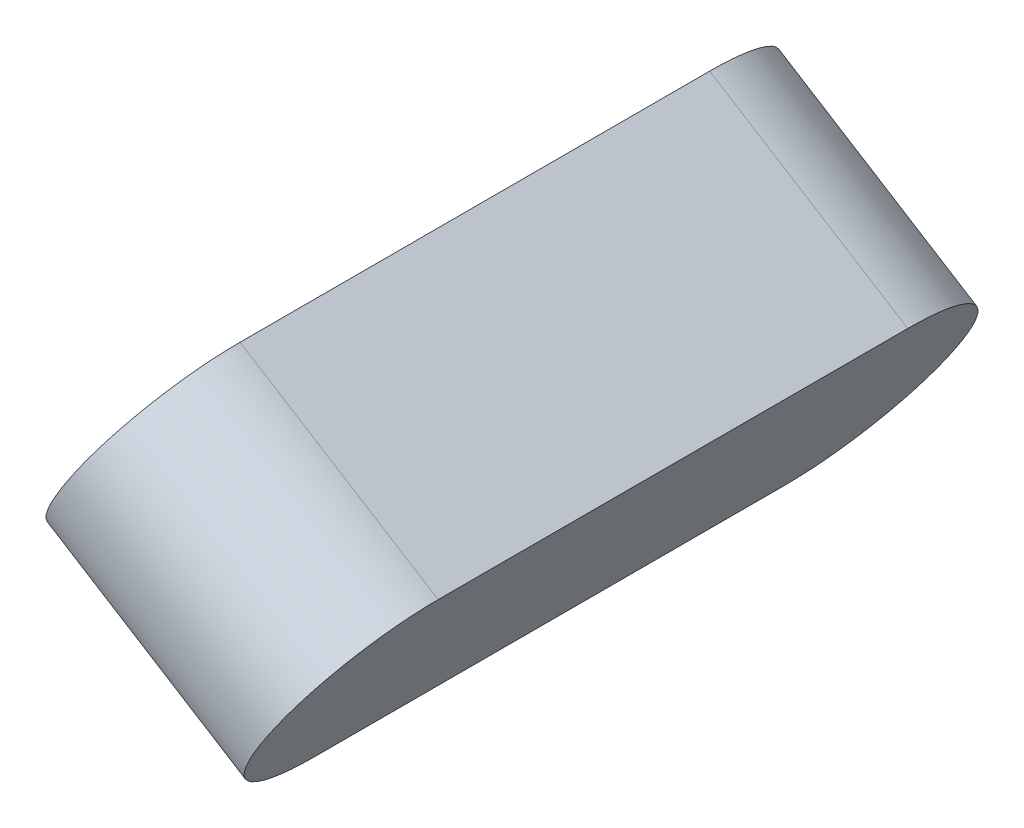
from build123d import *

# Parameters (mm, degrees)
BOSS_EXTRU_1_START = 35
BOSS_EXTRU_1_DEPTH = 20


with BuildPart() as part:
    # Esquisse1 → Boss.-Extru.1 (new body)
    with BuildSketch(Plane(origin=(-30.798605227, 19.249128267, 0), x_dir=(0, 0, 1), z_dir=(-0.8479983040028684, 0.5299989400067315, 0)).offset(BOSS_EXTRU_1_START)):
        with BuildLine():
            ThreePointArc((-145, -8.476131376), (-147.928932188, -1.405063564), (-155, 1.523868624))
            Line((-155, 1.523868624), (-155, -18.476131376))
            ThreePointArc((-155, -18.476131376), (-147.928932188, -15.547199188), (-145, -8.476131376))
        make_face()
        with BuildLine():
            Line((-155, -18.476131376), (-155, 1.523868624))
            ThreePointArc((-155, 1.523868624), (-165, -8.476131376), (-155, -18.476131376))
        make_face()
        with BuildLine():
            Line((-114.7986167, 1.523868624), (-155, 1.523868624))
            ThreePointArc((-155, 1.523868624), (-147.928932188, -1.405063564), (-145, -8.476131376))
            ThreePointArc((-145, -8.476131376), (-147.928932188, -15.547199188), (-155, -18.476131376))
            Line((-155, -18.476131376), (-114.7986167, -18.476131376))
            ThreePointArc((-114.7986167, -18.476131376), (-124.7986167, -8.476131376), (-114.7986167, 1.523868624))
        make_face()
        with BuildLine():
            ThreePointArc((-104.7986167, -8.476131376), (-107.727548888, -1.405063564), (-114.7986167, 1.523868624))
            Line((-114.7986167, 1.523868624), (-114.7986167, -18.476131376))
            ThreePointArc((-114.7986167, -18.476131376), (-107.727548888, -15.547199188), (-104.7986167, -8.476131376))
        make_face()
        with BuildLine():
            Line((-114.7986167, -18.476131376), (-114.7986167, 1.523868624))
            ThreePointArc((-114.7986167, 1.523868624), (-124.7986167, -8.476131376), (-114.7986167, -18.476131376))
        make_face()
    extrude(amount=-BOSS_EXTRU_1_DEPTH)


solid = part.part
